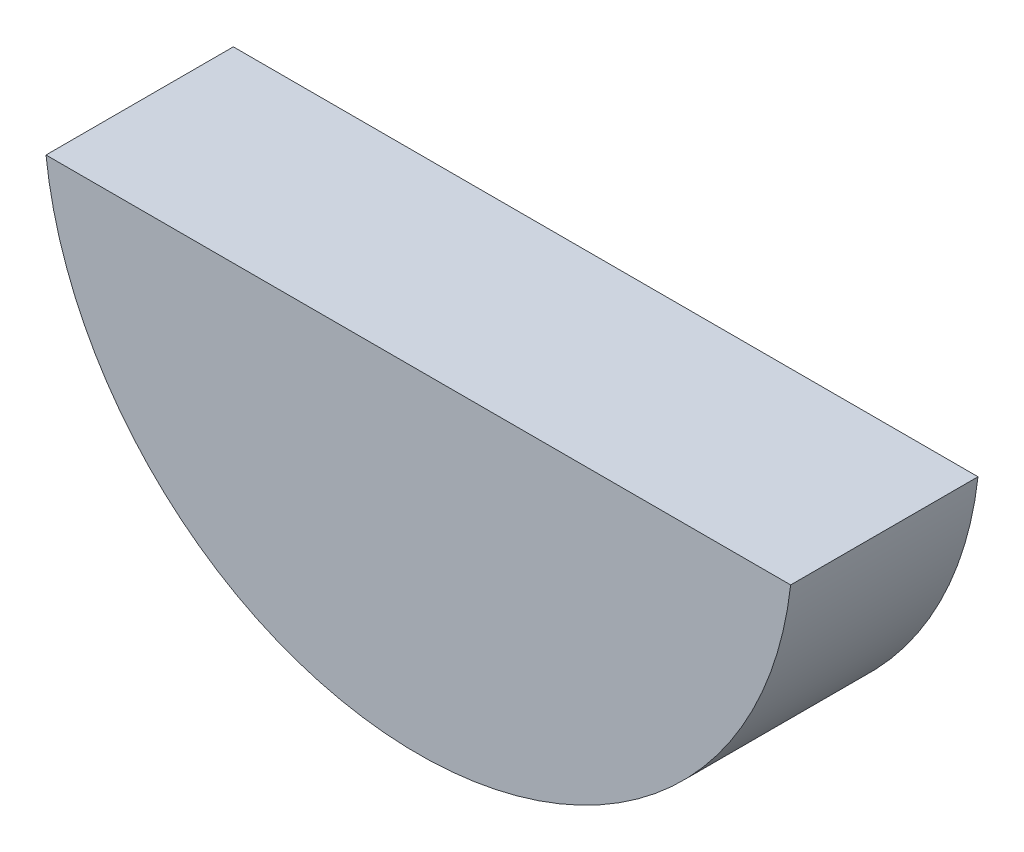
from build123d import *

# Parameters (mm, degrees)
SKETCH1_R      = 3.175
EXTRUDE1_DEPTH = 1.5875
EXTRUDE2_DEPTH = 5.7625


with BuildPart() as part:
    # Sketch1 → Extrude1 (new body)
    with BuildSketch(Plane.XY):
        Circle(SKETCH1_R)
    extrude(amount=EXTRUDE1_DEPTH)

    # Sketch2 → Extrude2 (cut, through all)
    with BuildSketch(Plane.XY.offset(1.5875)):
        with BuildLine():
            Line((-3.155070197, -0.355185939), (3.155070197, -0.355185939))
            ThreePointArc((3.155070197, -0.355185939), (0, 3.175), (-3.155070197, -0.355185939))
        make_face()
    extrude(amount=-EXTRUDE2_DEPTH, mode=Mode.SUBTRACT)


solid = part.part
